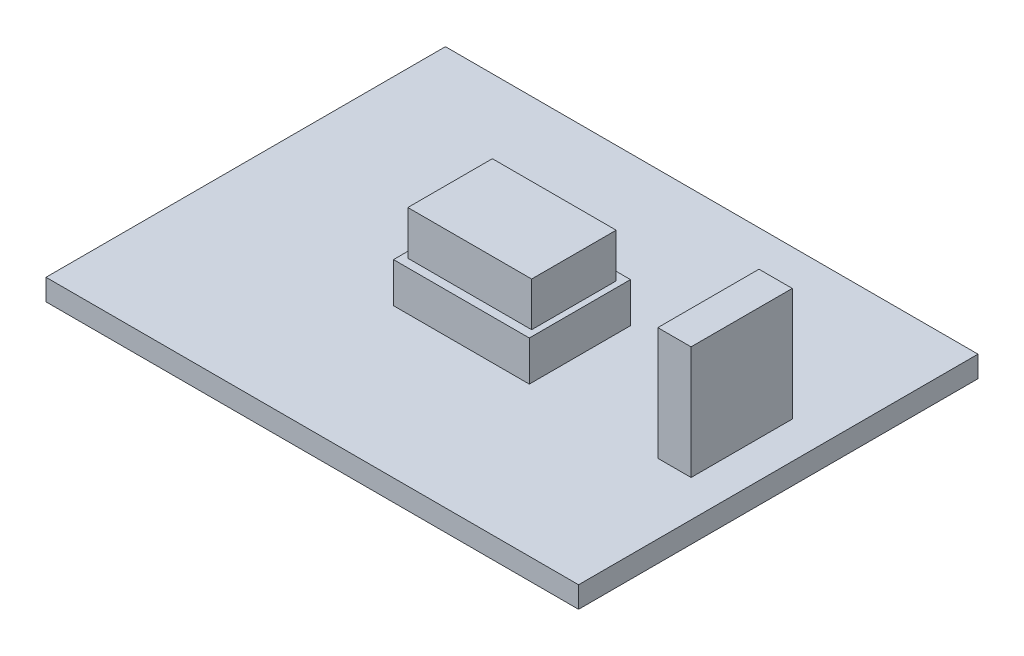
from build123d import *

# Parameters (mm, degrees)
SKETCH1_W         = 40
SKETCH1_H         = 30
PERFBOARD_DEPTH   = 1.6
DIP8_SOCKET_START = 1.6
SKETCH2_W         = 10.2
SKETCH2_H         = 7.6
DIP8_SOCKET_DEPTH = 3
CA3140_START      = 4.6
SKETCH3_W         = 9.3
SKETCH3_H         = 6.35
CA3140_DEPTH      = 3.3
HEADER_START      = 1.6
SKETCH4_W         = 2.5
SKETCH4_H         = 7.6
HEADER_DEPTH      = 8.5


with BuildPart() as part:
    # Sketch1 → Perfboard (new body)
    with BuildSketch(Plane(origin=(0, 0, 0), x_dir=(1, 0, 0), z_dir=(0, 1, 0))):
        Rectangle(SKETCH1_W, SKETCH1_H)
    extrude(amount=PERFBOARD_DEPTH)

    # Sketch2 → DIP8_Socket (add)
    with BuildSketch(Plane(origin=(0, 0, 0), x_dir=(1, 0, 0), z_dir=(0, 1, 0)).offset(DIP8_SOCKET_START)):
        Rectangle(SKETCH2_W, SKETCH2_H)
    extrude(amount=DIP8_SOCKET_DEPTH)

    # Sketch3 → CA3140 (add)
    with BuildSketch(Plane(origin=(0, 0, 0), x_dir=(1, 0, 0), z_dir=(0, 1, 0)).offset(CA3140_START)):
        Rectangle(SKETCH3_W, SKETCH3_H)
    extrude(amount=CA3140_DEPTH)

    # Sketch4 → Header (add)
    with BuildSketch(Plane(origin=(0, 0, 0), x_dir=(1, 0, 0), z_dir=(0, 1, 0)).offset(HEADER_START)):
        with Locations((16, 0)):
            Rectangle(SKETCH4_W, SKETCH4_H)
    extrude(amount=HEADER_DEPTH)


solid = part.part
